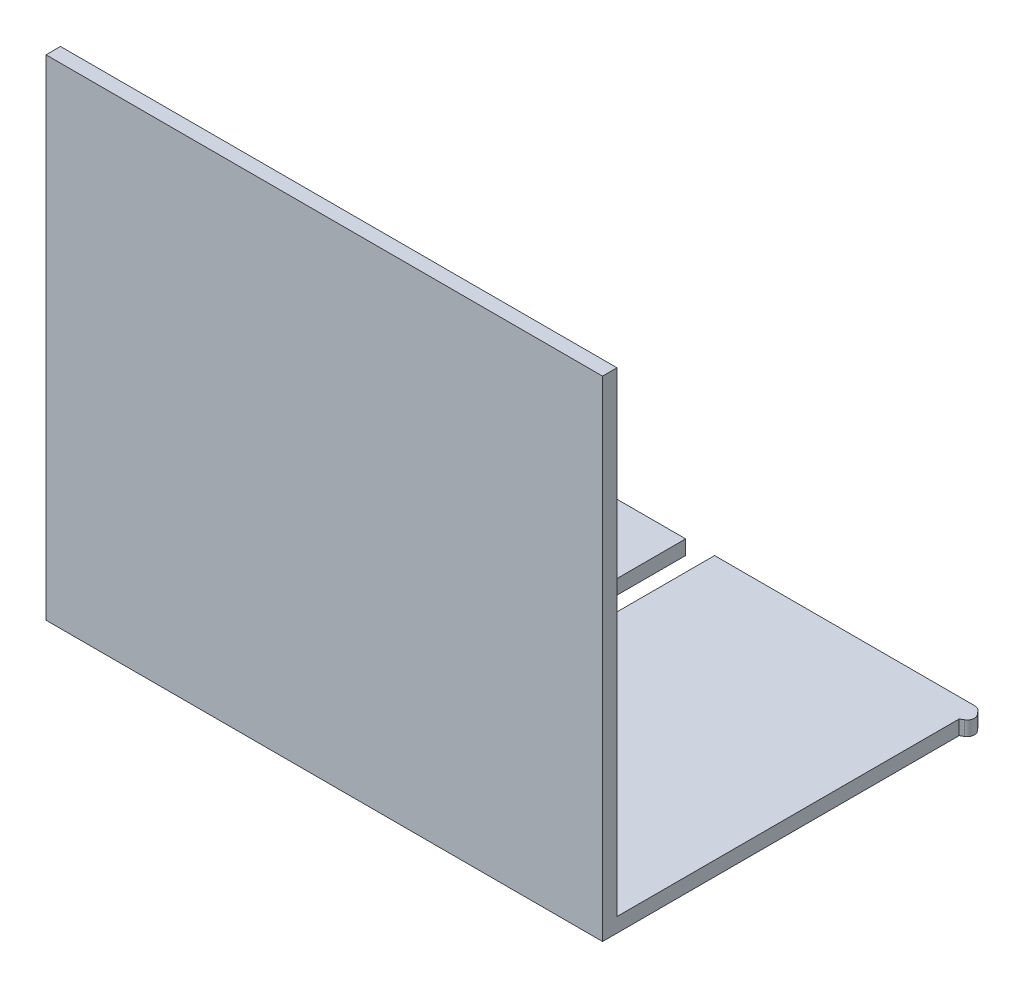
from build123d import *

# Parameters (mm, degrees)
SKETCH1_W           = 77
SKETCH1_H           = 50
BOSS_EXTRUDE1_DEPTH = 2
SKETCH2_W           = 77
SKETCH2_H           = 2
BOSS_EXTRUDE2_DEPTH = 67.75
CUT_EXTRUDE1_DEPTH  = 81.835094483
BOSS_EXTRUDE3_DEPTH = 2
FILLET1_R           = 1


with BuildPart() as part:
    # Sketch1 → Boss-Extrude1 (new body)
    with BuildSketch(Plane(origin=(0, 0, 0), x_dir=(1, 0, 0), z_dir=(0, 1, 0))):
        Rectangle(SKETCH1_W, SKETCH1_H)
    extrude(amount=BOSS_EXTRUDE1_DEPTH)

    # Sketch2 → Boss-Extrude2 (add)
    with BuildSketch(Plane.XZ):
        with Locations((0, 26)):
            Rectangle(SKETCH2_W, SKETCH2_H)
    extrude(amount=-BOSS_EXTRUDE2_DEPTH)

    # Sketch3 → Cut-Extrude1 (cut, through all)
    with BuildSketch(Plane(origin=(0, 2, 0), x_dir=(1, 0, 0), z_dir=(0, 1, 0))):
        with BuildLine():
            Line((2, 25), (2, -15))
            ThreePointArc((2, -15), (0, -17), (-2, -15))
            Line((-2, -15), (-2, 25))
            Line((-2, 25), (2, 25))
        make_face()
    extrude(amount=-CUT_EXTRUDE1_DEPTH, mode=Mode.SUBTRACT)

    # Sketch4 → Boss-Extrude3 (add)
    with BuildSketch(Plane(origin=(0, 2, 0), x_dir=(1, 0, 0), z_dir=(0, 1, 0))):
        Polygon((-38.5, 25), (-40, 23.212369611), (-38.5, 22.346344207), align=None)
        Polygon((40, 23.212369611), (38.5, 22.346344207), (38.5, 25), align=None)
    extrude(amount=-BOSS_EXTRUDE3_DEPTH)

    # Fillet1
    fillet1_edges = [part.edges().sort_by_distance(p)[0] for p in [
        (-40, 1, -23.212369611),
        (40, 1, -23.212369611),
        (-38.5, 1, -25),
        (38.5, 1, -25),
    ]]
    fillet(fillet1_edges, radius=FILLET1_R)


solid = part.part
